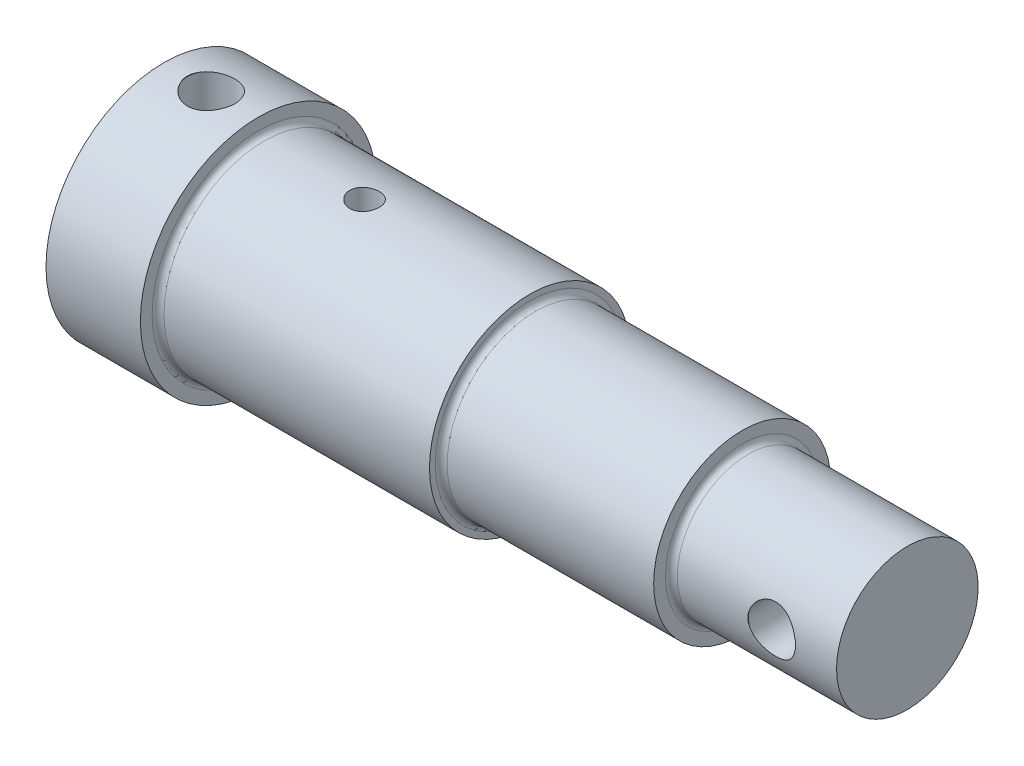
from build123d import *

# Parameters (mm, degrees)
F_12_0MM_DOWEL_HOLE1_D     = 12
F_12_0MM_DOWEL_HOLE1_DEPTH = 28
F_12_0MM_DOWEL_HOLE1_TIP   = 3.605163714
CUT_EXTRUDE2_DEPTH         = 3
M3X0_5_TAPPED_HOLE1_D      = 2.5
M3X0_5_TAPPED_HOLE1_DEPTH  = 6
M3X0_5_TAPPED_HOLE1_TIP    = 0.751075774
FILLET1_R                  = 0.5


with BuildPart() as part:
    # Sketch1 → Revolve1 (revolve)
    with BuildSketch(Plane.XY, mode=Mode.PRIVATE) as revolve1_sk:
        Polygon((0, 7.8), (0, 0), (64, 0), (64, 6), (50, 6), (50, 7.5), (32, 7.5), (32, 8.5), (16, 8.5), (9, 8.5), (9, 10), (1, 10), (1, 7.8), align=None)
    revolve(revolve1_sk.sketch.rotate(Axis((0, 0, 0), (1, 0, 0)), 90), axis=Axis((0, 0, 0), (1, 0, 0)))

    # Ø12.0mm Dowel Hole1
    with Locations(Plane.ZY):
        with Locations((0, 0)):
            Hole(F_12_0MM_DOWEL_HOLE1_D / 2, depth=F_12_0MM_DOWEL_HOLE1_DEPTH)
            with Locations((0, 0, -(F_12_0MM_DOWEL_HOLE1_DEPTH + F_12_0MM_DOWEL_HOLE1_TIP / 2))):  # 118° drill point
                Cone(0, F_12_0MM_DOWEL_HOLE1_D / 2, F_12_0MM_DOWEL_HOLE1_TIP, mode=Mode.SUBTRACT)

    # Sketch5 → Cut-Extrude2 (cut)
    with BuildSketch(Plane(origin=(0, -7.5, 0), x_dir=(-1, 0, 0), z_dir=(0, -1, 0))):
        with BuildLine():
            ThreePointArc((-46, -2.5), (-44.232233047, -1.767766953), (-43.5, 0))
            Line((-43.5, 0), (-48.5, 0))
            ThreePointArc((-48.5, -1.9e-08), (-47.767766946, -1.76776696), (-46, -2.5))
        make_face()
        with BuildLine():
            Line((-48.5, 0), (-43.5, 0))
            ThreePointArc((-43.5, 0), (-44.232233047, 1.767766953), (-46, 2.5))
            ThreePointArc((-46, 2.5), (-47.76776696, 1.767766946), (-48.5, -1.9e-08))
        make_face()
        with BuildLine():
            Line((-43.5, 0), (-38.5, 0))
            ThreePointArc((-38.5, 0), (-37.767766953, 1.767766953), (-36, 2.5))
            Line((-36, 2.5), (-46, 2.5))
            ThreePointArc((-46, 2.5), (-44.232233047, 1.767766953), (-43.5, 0))
        make_face()
        with BuildLine():
            ThreePointArc((-36, -2.5), (-37.767766953, -1.767766953), (-38.5, 0))
            Line((-38.5, 0), (-43.5, 0))
            ThreePointArc((-43.5, 0), (-44.232233047, -1.767766953), (-46, -2.5))
            Line((-46, -2.5), (-36, -2.5))
        make_face()
        with BuildLine():
            ThreePointArc((-36, -2.5), (-34.232233047, -1.767766953), (-33.5, 0))
            Line((-33.5, 0), (-38.5, 0))
            ThreePointArc((-38.5, 0), (-37.767766953, -1.767766953), (-36, -2.5))
        make_face()
        with BuildLine():
            Line((-38.5, 0), (-33.5, 0))
            ThreePointArc((-33.5, 0), (-34.232233047, 1.767766953), (-36, 2.5))
            ThreePointArc((-36, 2.5), (-37.767766953, 1.767766953), (-38.5, 0))
        make_face()
    extrude(amount=-CUT_EXTRUDE2_DEPTH, mode=Mode.SUBTRACT)

    # M3x0.5 Tapped Hole1
    with Locations(Plane(origin=(0, 8.5, 0), x_dir=(1, 0, 0), z_dir=(0, 1, 0))):
        with Locations((18, 0)):
            Hole(M3X0_5_TAPPED_HOLE1_D / 2, depth=M3X0_5_TAPPED_HOLE1_DEPTH)
            with Locations((0, 0, -(M3X0_5_TAPPED_HOLE1_DEPTH + M3X0_5_TAPPED_HOLE1_TIP / 2))):  # 118° drill point
                Cone(0, M3X0_5_TAPPED_HOLE1_D / 2, M3X0_5_TAPPED_HOLE1_TIP, mode=Mode.SUBTRACT)

    # Sketch11 → Ø4.0mm Dowel Hole1 (revolve, cut)
    with BuildSketch(Plane(origin=(5, 10, 0), x_dir=(0, 0, 1), z_dir=(1, 0, 0))):
        Polygon((0, 0), (0, 20), (2.025, 20), (2, 19.975), (2, 0.025), (2.025, 0), align=None)
    revolve(axis=Axis((5, 16.35, 0), (0, -1, 0)), mode=Mode.SUBTRACT)

    # Sketch12 → Ø4.0mm Dowel Hole2 (revolve, cut)
    with BuildSketch(Plane(origin=(58.5, 0, 6), x_dir=(0, -1, 0), z_dir=(1, 0, 0))):
        Polygon((0, 0), (0, 12), (2.025, 12), (2, 11.975), (2, 0.025), (2.025, 0), align=None)
    revolve(axis=Axis((58.5, 0, 12.35), (0, 0, -1)), mode=Mode.SUBTRACT)

    # Fillet1
    fillet1_edges = [part.edges().sort_by_distance(p)[0] for p in [
        (32, 0, -7.5),
        (50, 0, -6),
        (1, 0, -7.8),
        (9, 0, -8.5),
    ]]
    fillet(fillet1_edges, radius=FILLET1_R)


solid = part.part
